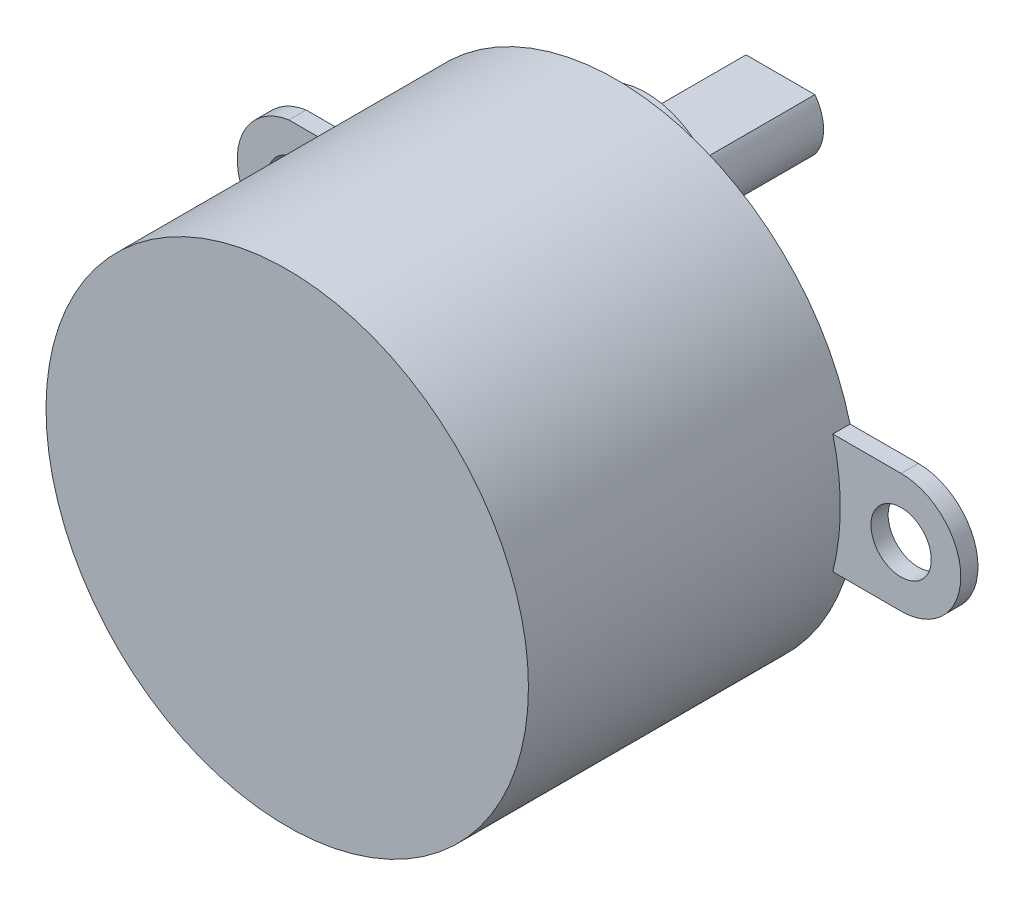
from build123d import *

# Parameters (mm, degrees)
SKETCH1_R           = 14
BOSS_EXTRUDE1_DEPTH = 19.1
SKETCH1_3_R         = 4.5
BOSS_EXTRUDE2_DEPTH = 1.7
BOSS_EXTRUDE4_DEPTH = 2.3
BOSS_EXTRUDE5_DEPTH = 9.5
BOSS_EXTRUDE6_DEPTH = 2.3
SKETCH1_9_R         = 1.75
BOSS_EXTRUDE7_DEPTH = 1


with BuildPart() as part:
    # Sketch1 → Boss-Extrude1 (new body)
    with BuildSketch(Plane.XY):
        Circle(SKETCH1_R)
    extrude(amount=BOSS_EXTRUDE1_DEPTH)

    # Sketch1<3> → Boss-Extrude2 (add)
    with BuildSketch(Plane.XY):
        with Locations((0.027687475, 7.999952088)):
            Circle(SKETCH1_3_R)
        with BuildLine():
            ThreePointArc((-1.972312525, 6.499952088), (-2.472312525, 7.999952088), (-1.972312525, 9.499952088))
            ThreePointArc((-1.972312525, 9.499952088), (0.027687475, 10.499952088), (2.027687475, 9.499952088))
            ThreePointArc((2.027687475, 9.499952088), (2.39939572, 8.790521503), (2.527687475, 7.999952088))
            ThreePointArc((2.527687475, 7.999952088), (2.39939572, 7.209382673), (2.027687475, 6.499952088))
            ThreePointArc((2.027687475, 6.499952088), (0.027687475, 5.499952088), (-1.972312525, 6.499952088))
        make_face(mode=Mode.SUBTRACT)
    extrude(amount=-BOSS_EXTRUDE2_DEPTH)

    # Sketch1<6> → Boss-Extrude4 (add)
    with BuildSketch(Plane.XY):
        with BuildLine():
            Line((-1.972312525, 9.499952088), (0.027687475, 9.499952088))
            Line((0.027687475, 9.499952088), (2.027687475, 9.499952088))
            ThreePointArc((2.027687475, 9.499952088), (0.027687475, 10.499952088), (-1.972312525, 9.499952088))
        make_face()
    extrude(amount=-BOSS_EXTRUDE4_DEPTH)

    # Sketch1<7> → Boss-Extrude5 (add)
    with BuildSketch(Plane.XY):
        with BuildLine():
            Line((2.027687475, 9.499952088), (-1.972312525, 9.499952088))
            ThreePointArc((-1.972312525, 9.499952088), (-2.472312525, 7.999952088), (-1.972312525, 6.499952088))
            Line((-1.972312525, 6.499952088), (2.027687475, 6.499952088))
            ThreePointArc((2.027687475, 6.499952088), (2.527687475, 7.999952088), (2.027687475, 9.499952088))
        make_face()
    extrude(amount=-BOSS_EXTRUDE5_DEPTH)

    # Sketch1<8> → Boss-Extrude6 (add)
    with BuildSketch(Plane.XY):
        with BuildLine():
            Line((2.027687475, 6.499952088), (0.027687475, 6.499952088))
            Line((0.027687475, 6.499952088), (-1.972312525, 6.499952088))
            ThreePointArc((-1.972312525, 6.499952088), (0.027687475, 5.499952088), (2.027687475, 6.499952088))
        make_face()
    extrude(amount=-BOSS_EXTRUDE6_DEPTH)

    # Sketch1<9> → Boss-Extrude7 (add)
    # profile 1 of 2: a face of its own
    with BuildSketch(Plane.XY):
        with BuildLine():
            Line((-13.564798107, 3.46356064), (-18.003733752, 3.46356064))
            ThreePointArc((-18.003733752, 3.46356064), (-21, 0), (-18.003733752, -3.46356064))
            Line((-18.003733752, -3.46356064), (-13.564798107, -3.46356064))
            ThreePointArc((-13.564798107, -3.46356064), (-14, 0), (-13.564798107, 3.46356064))
        make_face()
        with Locations((-17.5, 0)):
            Circle(SKETCH1_9_R, mode=Mode.SUBTRACT)
    # profile 2 of 2: a face of its own
    with BuildSketch(Plane.XY):
        with BuildLine():
            Line((17.527687475, 3.46356064), (13.564798107, 3.46356064))
            ThreePointArc((13.564798107, 3.46356064), (14, 0), (13.564798107, -3.46356064))
            Line((13.564798107, -3.46356064), (17.527687475, -3.46356064))
            ThreePointArc((17.527687475, -3.46356064), (20.991248115, 0), (17.527687475, 3.46356064))
        make_face()
        with Locations((17.527687475, 0)):
            Circle(SKETCH1_9_R, mode=Mode.SUBTRACT)
    extrude(amount=BOSS_EXTRUDE7_DEPTH)


solid = part.part
